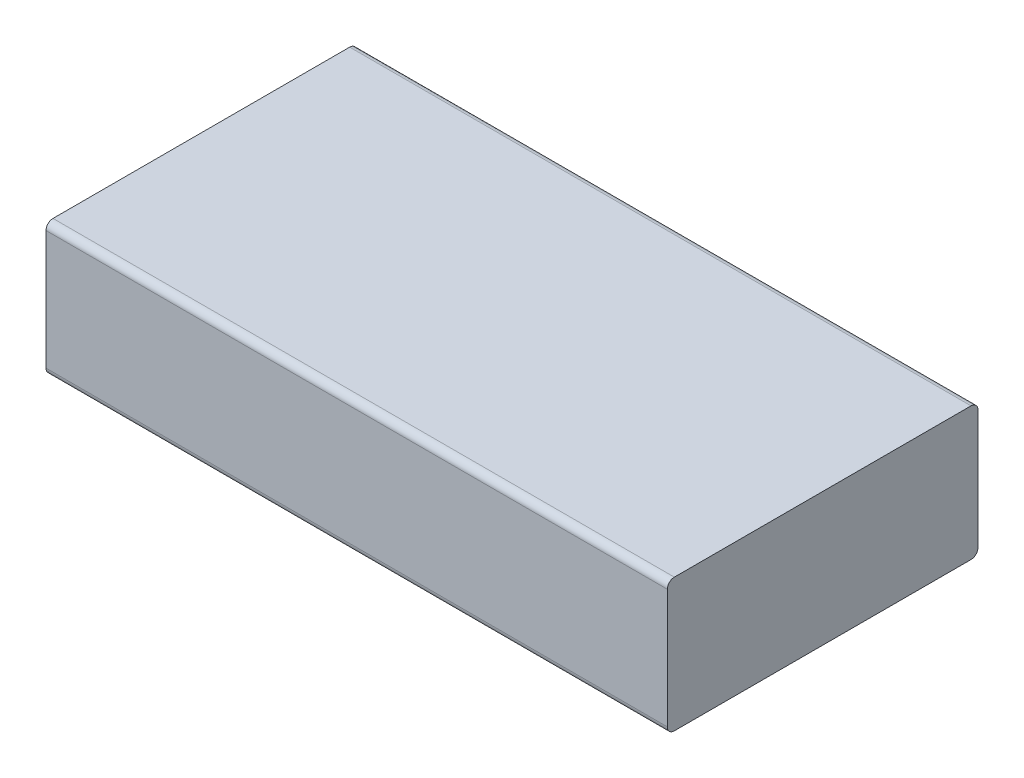
from build123d import *

# Parameters (mm, degrees)
SKETCH1_W           = 88.9
SKETCH1_H           = 38.1
BOSS_EXTRUDE1_DEPTH = 177.8
FILLET1_R           = 2


with BuildPart() as part:
    # Sketch1 → Boss-Extrude1 (new body)
    with BuildSketch(Plane(origin=(0, 0, 0), x_dir=(0, 0, -1), z_dir=(1, 0, 0))):
        Rectangle(SKETCH1_W, SKETCH1_H)
    extrude(amount=BOSS_EXTRUDE1_DEPTH)

    # Fillet1
    fillet1_edges = [part.edges().sort_by_distance(p)[0] for p in [
        (88.9, -19.05, -44.45),
        (88.9, -19.05, 44.45),
        (88.9, 19.05, 44.45),
        (88.9, 19.05, -44.45),
    ]]
    fillet(fillet1_edges, radius=FILLET1_R)


solid = part.part
